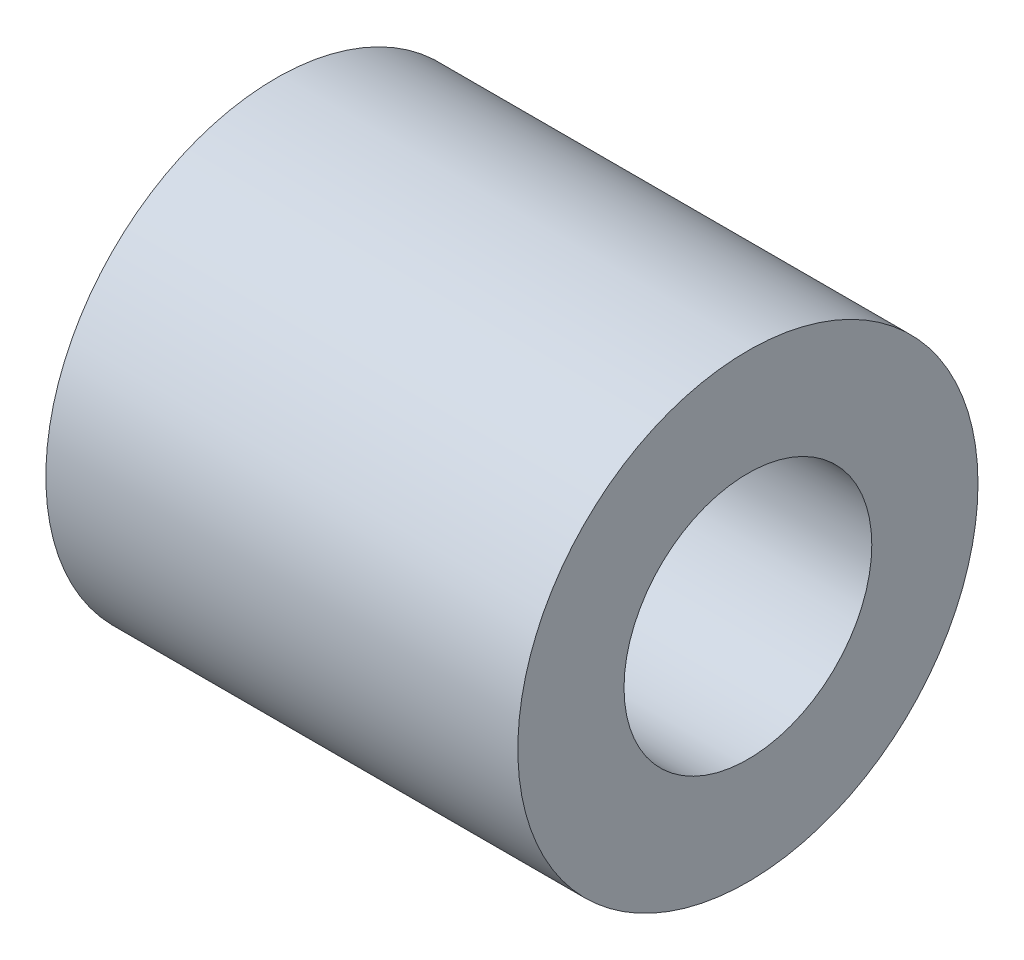
from build123d import *

# Parameters (mm, degrees)
SKETCH1_R           = 5.85
SKETCH1_R_2         = 3.15
BOSS_EXTRUDE1_DEPTH = 12


with BuildPart() as part:
    # Sketch1 → Boss-Extrude1 (new body)
    with BuildSketch(Plane(origin=(0, 0, 0), x_dir=(0, 0, -1), z_dir=(1, 0, 0))):
        Circle(SKETCH1_R)
        Circle(SKETCH1_R_2, mode=Mode.SUBTRACT)
    extrude(amount=BOSS_EXTRUDE1_DEPTH)


solid = part.part
